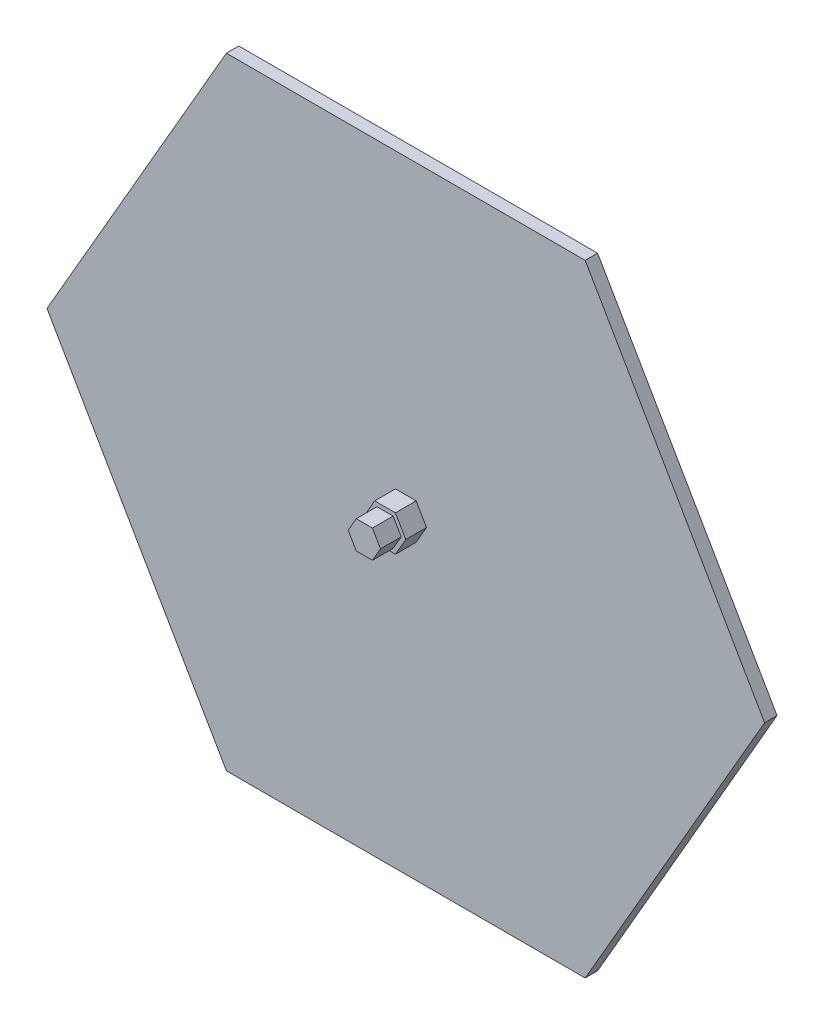
from build123d import *

# Parameters (mm, degrees)
SALIENTE_EXTRUIR1_DEPTH = 3.000000026
SALIENTE_EXTRUIR2_DEPTH = 5.000000354
SALIENTE_EXTRUIR3_DEPTH = 4.999999888


with BuildPart() as part:
    # Croquis1 → Saliente-Extruir1 (new body)
    with BuildSketch(Plane(origin=(0, 0, 0), x_dir=(-1, 0, 0), z_dir=(0, 0, -1))):
        Polygon((86.602535383, 0), (43.301267691, 75), (-43.301267691, 75), (-86.602535383, 0), (-43.301267691, -75), (43.301267691, -75), align=None)
    extrude(amount=-SALIENTE_EXTRUIR1_DEPTH)

    # Croquis2 → Saliente-Extruir2 (add)
    with BuildSketch(Plane.XY.offset(3.000000026)):
        Polygon((-2.499997616, 4.330128431), (2.499997616, 4.330128431), (5.000002682, 0), (2.499997616, -4.330128431), (-2.499997616, -4.330128431), (-5.000002682, 0), align=None)
    extrude(amount=SALIENTE_EXTRUIR2_DEPTH)

    # Croquis3 → Saliente-Extruir3 (add)
    with BuildSketch(Plane.XY.offset(8.00000038)):
        Polygon((-1.949995756, -3.377497196), (-3.899998963, 0), (-1.949995756, 3.377497196), (1.949995756, 3.377497196), (3.899998963, 0), (1.949995756, -3.377497196), align=None)
    extrude(amount=SALIENTE_EXTRUIR3_DEPTH)


solid = part.part
